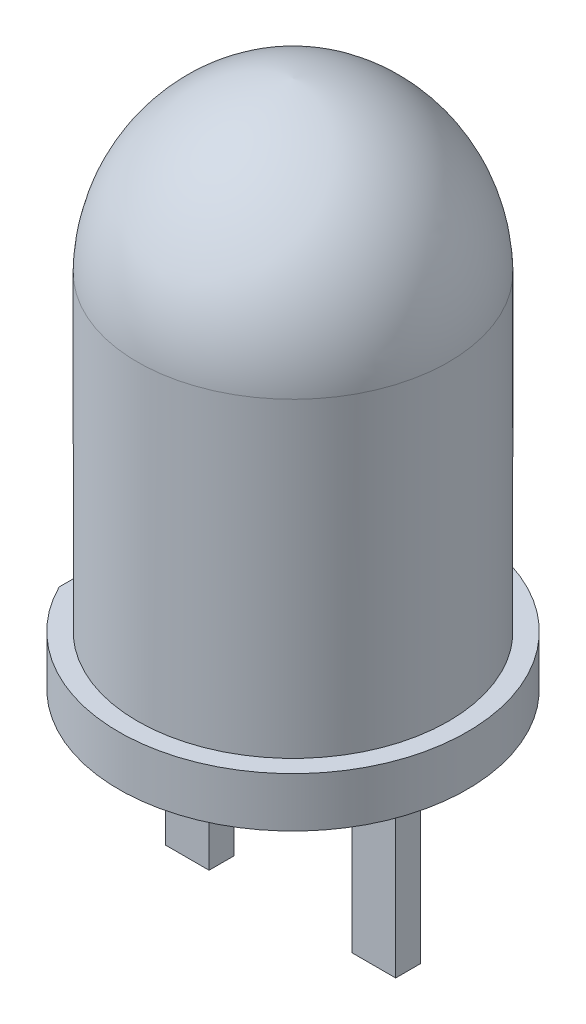
from build123d import *

# Parameters (mm, degrees)
CORTAR_EXTRUIR1_START   = -10
CORTAR_EXTRUIR1_DEPTH   = 10
CROQUIS3_W              = 0.7
CROQUIS3_H              = 0.4
SALIENTE_EXTRUIR1_DEPTH = 3


with BuildPart() as part:
    # Croquis1 → Revolución1 (revolve)
    with BuildSketch(Plane.XY, mode=Mode.PRIVATE) as revoluci_n1_sk:
        with BuildLine():
            Line((0, 0), (0, 8.5))
            ThreePointArc((0, 8.5), (1.768113296, 7.629734533), (2.5, 5.8))
            Line((2.5, 5.8), (2.5, 0.8))
            Line((2.5, 0.8), (2.8, 0.8))
            Line((2.8, 0.8), (2.8, 0))
            Line((2.8, 0), (0, 0))
        make_face()
    revolve(revoluci_n1_sk.sketch.rotate(Axis((0, 0, 0), (0, 1, 0)), 90), axis=Axis((0, 0, 0), (0, 1, 0)))

    # Croquis2 → Cortar-Extruir1 (cut)
    with BuildSketch(Plane(origin=(0, 0.8, 0), x_dir=(1, 0, 0), z_dir=(0, 1, 0)).offset(CORTAR_EXTRUIR1_START)):
        with BuildLine():
            Line((-2.5, -1.260952021), (-2.5, 0))
            Line((-2.5, 0), (-2.8, 0))
            ThreePointArc((-2.8, 0), (-2.723967694, -0.64807407), (-2.5, -1.260952021))
        make_face()
        with BuildLine():
            Line((-2.8, 0), (-2.5, 0))
            Line((-2.5, 0), (-2.5, 1.260952021))
            ThreePointArc((-2.5, 1.260952021), (-2.723967694, 0.64807407), (-2.8, 0))
        make_face()
    extrude(amount=CORTAR_EXTRUIR1_DEPTH, mode=Mode.SUBTRACT)

    # Croquis3 → Saliente-Extruir1 (add)
    with BuildSketch(Plane.XZ):
        with Locations((-1.5, 0)):
            Rectangle(CROQUIS3_W, CROQUIS3_H)
        with Locations((1.5, 0)):
            Rectangle(CROQUIS3_W, CROQUIS3_H)
    extrude(amount=SALIENTE_EXTRUIR1_DEPTH)


solid = part.part
